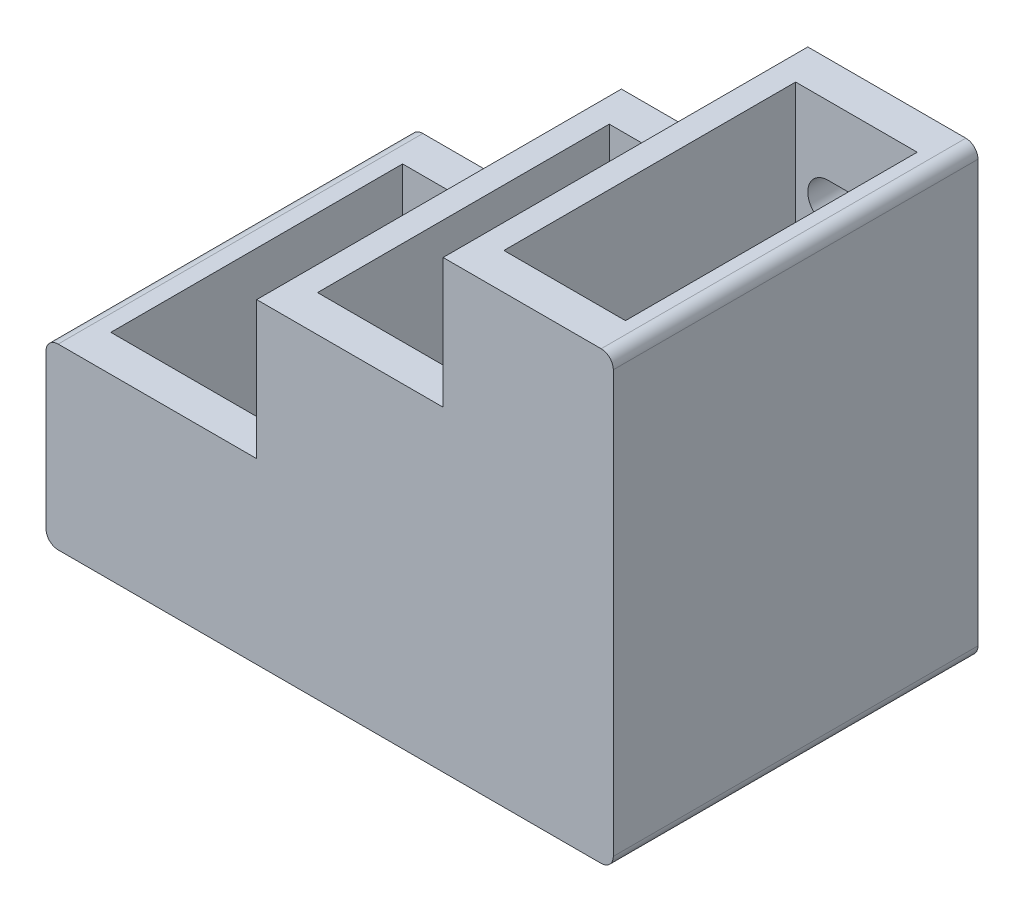
from build123d import *

# Parameters (mm, degrees)
EXTRUDE_1_DEPTH      = 90
SKETCH_2_W           = 38
SKETCH_2_H           = 72
CUT_EXTRUDE_1_DEPTH  = 36
SKETCH_4_W           = 34
SKETCH_4_H           = 72
CUT_EXTRUDE_3_DEPTH  = 70
SKETCH_5_W           = 30
SKETCH_5_H           = 72
CUT_EXTRUDE_4_DEPTH  = 102
SKETCH_7_W           = 26
SKETCH_7_H           = 14
CUT_EXTRUDE_6_DEPTH  = 1.5
FILLET_2_R           = 3
CUT_EXTRUDE_11_DEPTH = 9.5
CUT_EXTRUDE_12_DEPTH = 9.5


with BuildPart() as part:
    # 草图1 → 凸台-拉伸1 (new body)
    with BuildSketch(Plane.XY):
        Polygon((-70, 0), (70, 0), (70, 110), (28, 110), (28, 78), (-18, 78), (-18, 44), (-70, 44), align=None)
    extrude(amount=EXTRUDE_1_DEPTH)

    # 草图2 → 切除-拉伸1 (cut)
    with BuildSketch(Plane(origin=(0, 44, 0), x_dir=(1, 0, 0), z_dir=(0, 1, 0))):
        with Locations((-44, -45)):
            Rectangle(SKETCH_2_W, SKETCH_2_H)
    extrude(amount=-CUT_EXTRUDE_1_DEPTH, mode=Mode.SUBTRACT)

    # 草图4 → 切除-拉伸3 (cut)
    with BuildSketch(Plane(origin=(0, 78, 0), x_dir=(1, 0, 0), z_dir=(0, 1, 0))):
        with Locations((5, -45)):
            Rectangle(SKETCH_4_W, SKETCH_4_H)
    extrude(amount=-CUT_EXTRUDE_3_DEPTH, mode=Mode.SUBTRACT)

    # 草图5 → 切除-拉伸4 (cut)
    with BuildSketch(Plane(origin=(0, 110, 0), x_dir=(1, 0, 0), z_dir=(0, 1, 0))):
        with Locations((49, -45)):
            Rectangle(SKETCH_5_W, SKETCH_5_H)
    extrude(amount=-CUT_EXTRUDE_4_DEPTH, mode=Mode.SUBTRACT)

    # 草图7 → 切除-拉伸6 (cut)
    with BuildSketch(Plane(origin=(0, 0, 0), x_dir=(1, 0, 0), z_dir=(0, 1, 0))):
        with Locations((-44, -45)):
            Rectangle(SKETCH_7_W, SKETCH_7_H)
        with Locations((49, -45)):
            Rectangle(SKETCH_7_W, SKETCH_7_H)
    extrude(amount=CUT_EXTRUDE_6_DEPTH, mode=Mode.SUBTRACT)

    # 圆角2
    fillet_2_edges = [part.edges().sort_by_distance(p)[0] for p in [
        (-70, 44, 45),
        (70, 110, 45),
        (70, 0, 45),
        (-70, 0, 45),
    ]]
    fillet(fillet_2_edges, radius=FILLET_2_R)

    # 草图12 → 切除-拉伸11 (cut)
    with BuildSketch(Plane.XY):
        with BuildLine():
            Line((-49.5, 27), (-38.5, 27))
            ThreePointArc((-38.5, 27), (-37.439339828, 27.439339828), (-37, 28.5))
            Line((-37, 28.5), (-37, 35.5))
            ThreePointArc((-37, 35.5), (-37.439339828, 36.560660172), (-38.5, 37))
            Line((-38.5, 37), (-49.5, 37))
            ThreePointArc((-49.5, 37), (-50.560660172, 36.560660172), (-51, 35.5))
            Line((-51, 35.5), (-51, 28.5))
            ThreePointArc((-51, 28.5), (-50.560660172, 27.439339828), (-49.5, 27))
        make_face()
    extrude(amount=CUT_EXTRUDE_11_DEPTH, mode=Mode.SUBTRACT)

    # 草图13 → 切除-拉伸12 (cut)
    with BuildSketch(Plane.XY):
        with BuildLine():
            Line((42, 83), (56, 83))
            ThreePointArc((56, 83), (61, 88), (56, 93))
            Line((56, 93), (42, 93))
            ThreePointArc((42, 93), (37, 88), (42, 83))
        make_face()
    extrude(amount=CUT_EXTRUDE_12_DEPTH, mode=Mode.SUBTRACT)


solid = part.part
